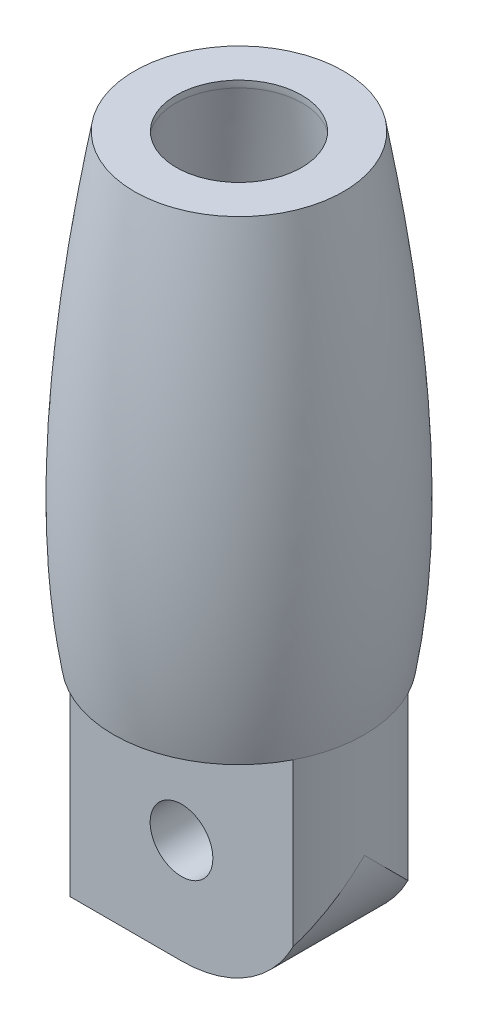
from build123d import *

# Parameters (mm, degrees)
BOSS_EXTRUDE1_DEPTH     = 2.75
CUT_EXTRUDE5_DEPTH      = 14
CUT_EXTRUDE5_DEPTH_BACK = 14
SKETCH5_R               = 1.5
SKETCH6_OUTSIDE_W       = 22.626
SKETCH6_OUTSIDE_H       = 22.626
SKETCH6_OUTSIDE_R       = 6
CUT_EXTRUDE6_DEPTH      = 24.860169667
SKETCH7_R               = 1
CUT_EXTRUDE7_DEPTH      = 20
SKETCH8_R               = 1


with BuildPart() as part:
    # Sketch1 → Revolve1 (revolve)
    with BuildSketch(Plane(origin=(0, 0, 0), x_dir=(0, 0, -1), z_dir=(1, 0, 0))):
        with BuildLine():
            Line((0, 2), (0, 0))
            Line((0, 0), (6, 0))
            add(Edge.make_bspline(
                [(5, 22), (7.432624423, 8.203901334), (6, 0)],
                knots=[0, 0, 0, 1, 1, 1], degree=2))
            Line((5, 22), (3, 22))
            add(Edge.make_bspline(
                [(3.030384494, 21.652703645), (3.016873864, 21.729326237), (3, 22)],
                knots=[0, 0, 0, 1, 1, 1], degree=2))
            add(Edge.make_bspline(
                [(3.030384494, 21.652703645), (3.725648232, 17.709667047), (4.838461357, 7.341433009), (4.295069583, 2.215324441), (4.269810085, 2)],
                knots=[0, 0, 0, 0.289998028, 0.869994084, 0.895995268, 0.895995268, 0.895995268], degree=2))
            Line((4.269810085, 2), (0, 2))
        make_face()
    revolve(axis=Axis((0, 0, 0), (0, 1, 0)))

    # Sketch3 → Boss-Extrude1 (add, symmetric)
    with BuildSketch(Plane.XY):
        with BuildLine():
            Line((-6, 0), (-6, -11))
            Line((-6, -11), (0, -11))
            ThreePointArc((0, -11), (4.242640687, -9.242640687), (6, -5))
            Line((6, -5), (6, 0))
            Line((6, 0), (-6, 0))
        make_face()
    extrude(amount=BOSS_EXTRUDE1_DEPTH, both=True)

    # Sketch5 → Cut-Extrude5 (cut, two sides: drawn at the far end of the back side and taken through both)
    with BuildSketch(Plane.XY.offset(-CUT_EXTRUDE5_DEPTH_BACK)):
        with Locations((0, -6)):
            Circle(SKETCH5_R)
    extrude(amount=CUT_EXTRUDE5_DEPTH + CUT_EXTRUDE5_DEPTH_BACK, mode=Mode.SUBTRACT)

    # Sketch6 outside → Cut-Extrude6 (cut, through all)
    with BuildSketch(Plane(origin=(0, 0, 0), x_dir=(1, 0, 0), z_dir=(0, 1, 0))):
        Rectangle(SKETCH6_OUTSIDE_W, SKETCH6_OUTSIDE_H)
        Circle(SKETCH6_OUTSIDE_R, mode=Mode.SUBTRACT)
    extrude(amount=-CUT_EXTRUDE6_DEPTH, mode=Mode.SUBTRACT)

    # Sketch7 → Cut-Extrude7 (cut)
    with BuildSketch(Plane.XZ.offset(11)):
        with Locations(Location((3, 0, 0), (0, 0, 270))):
            Circle(SKETCH7_R)
    extrude(amount=-CUT_EXTRUDE7_DEPTH, mode=Mode.SUBTRACT)

    # Cut-Sweep1: sweep along a path in Sketch10
    with BuildLine() as cut_sweep1_path:  # in the path sketch's own coordinates; laid on its plane below (add() does not lay a ready-made edge on the line's plane)
        add(Edge.make_bspline(
            [(-6, -5.5), (-2.332682252, -5.5), (-2.332682252, 2)],
            knots=[0, 0, 0, 1, 1, 1], degree=2))
    # Sketch8 → Cut-Sweep1 (sweep, cut)
    with BuildSketch(Plane.ZY.offset(6)):
        with Locations((0, -5.5)):
            Circle(SKETCH8_R)
    sweep(path=Plane.XY * cut_sweep1_path.line, mode=Mode.SUBTRACT)


solid = part.part
